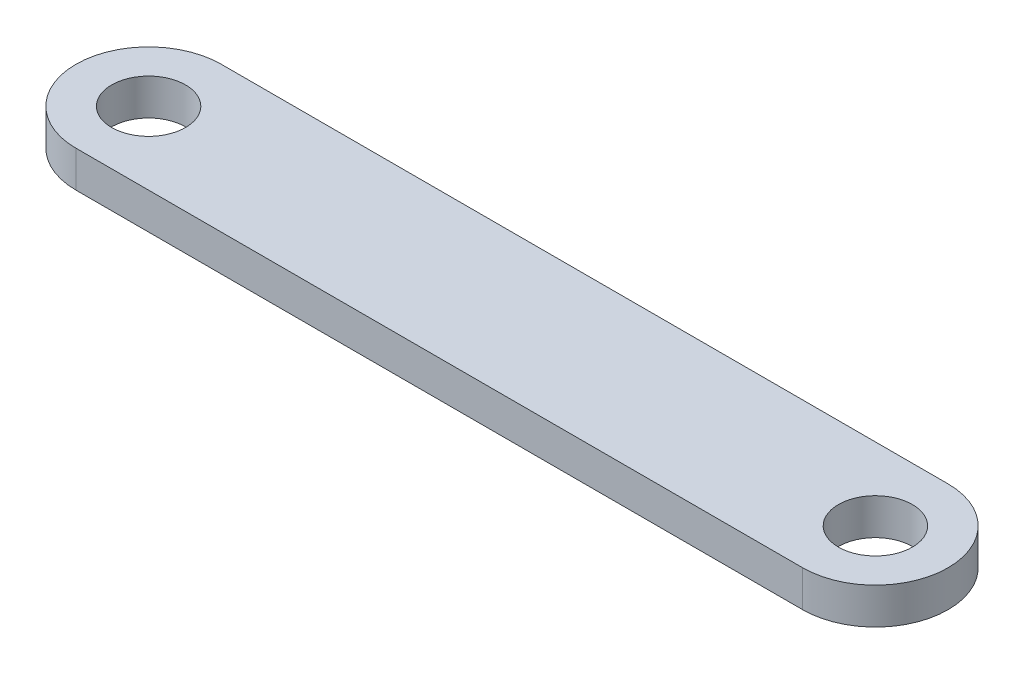
from build123d import *

# Parameters (mm, degrees)
SKETCH1_R           = 3.05
BOSS_EXTRUDE1_DEPTH = 3


with BuildPart() as part:
    # Sketch1 → Boss-Extrude1 (new body)
    with BuildSketch(Plane(origin=(0, 0, 0), x_dir=(1, 0, 0), z_dir=(0, 1, 0))):
        with BuildLine():
            Line((0, 6), (60, 6))
            ThreePointArc((60, 6), (66, 0), (60, -6))
            Line((60, -6), (0, -6))
            ThreePointArc((0, -6), (-6, 0), (0, 6))
        make_face()
        with Locations(Location((0, 0, 0), (0, 0, 270))):
            Circle(SKETCH1_R, mode=Mode.SUBTRACT)
        with Locations(Location((60, 0, 0), (0, 0, 270))):
            Circle(SKETCH1_R, mode=Mode.SUBTRACT)
    extrude(amount=BOSS_EXTRUDE1_DEPTH)


solid = part.part
